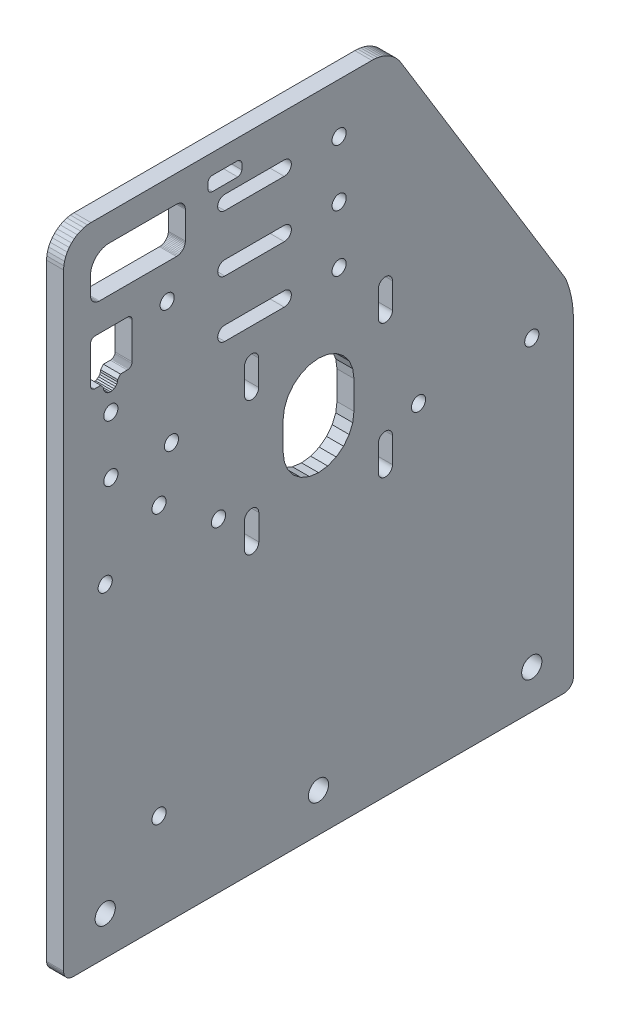
from build123d import *

# Parameters (mm, degrees)
SKETCH1_R           = 3.5685
SKETCH1_R_2         = 2.500000001
SKETCH1_R_3         = 2.5
BOSS_EXTRUDE1_DEPTH = 6


with BuildPart() as part:
    # Sketch1 → Boss-Extrude1 (new body)
    with BuildSketch(Plane(origin=(0, 0, 0), x_dir=(0, -1, 0), z_dir=(-1, 0, 0))):
        Polygon((-590.212112636, -1614.243728334), (-495.230350852, -1672.335619946), (-492.985489602, -1673.198794727), (-490.688058814, -1673.910331453), (-488.34828871, -1674.467061724), (-485.976598042, -1674.866506478), (-483.583547703, -1675.10688703), (-481.179793697, -1675.18713299), (-371.826596113, -1675.18713299), (-371.387664827, -1675.158363913), (-370.956243777, -1675.072548931), (-370.539714696, -1674.931156361), (-370.145204514, -1674.736605469), (-369.779463407, -1674.492225074), (-369.448749309, -1674.202196594), (-369.158720829, -1673.871482496), (-368.914340435, -1673.50574139), (-368.719789543, -1673.111231207), (-368.578396973, -1672.694702127), (-368.49258199, -1672.263281077), (-368.463812914, -1671.82434979), (-368.463812914, -1498.50991619), (-368.49258199, -1498.070984903), (-368.578396973, -1497.639563853), (-368.719789543, -1497.223034773), (-368.914340435, -1496.82852459), (-369.158720829, -1496.462783484), (-369.448749309, -1496.132069386), (-369.779463407, -1495.842040906), (-370.145204514, -1495.597660511), (-370.539714696, -1495.403109619), (-370.956243777, -1495.261717049), (-371.387664827, -1495.175902067), (-371.826596113, -1495.14713299), (-586.288106544, -1495.145619765), (-587.549717355, -1495.228301598), (-588.789742622, -1495.474950056), (-589.98696498, -1495.881344878), (-591.12089944, -1496.440532473), (-592.172143895, -1497.142944902), (-593.122711102, -1497.976563587), (-593.956336446, -1498.927124952), (-594.658756242, -1499.978364486), (-595.217951782, -1501.112295027), (-595.624354993, -1502.309514537), (-595.87101214, -1503.549538076), (-595.953702813, -1504.811148308), (-595.953702813, -1603.994310614), (-595.910202971, -1605.015955139), (-595.780018321, -1606.030204482), (-595.564091204, -1607.029716989), (-595.263984611, -1608.007257681), (-594.881870865, -1608.955750621), (-594.420515902, -1609.868330136), (-593.883259242, -1610.738390509), (-593.273989822, -1611.559633802), (-592.597117845, -1612.326115438), (-591.857542854, -1613.032287234), (-591.060618269, -1613.673037558), align=None)
        with Locations(Location((-382.159118976, -1509.84713299, 0), (0, 0, 90))):
            Circle(SKETCH1_R, mode=Mode.SUBTRACT)
        with Locations(Location((-382.159118976, -1585.16713299, 0), (0, 0, 90))):
            Circle(SKETCH1_R, mode=Mode.SUBTRACT)
        with Locations(Location((-382.159118976, -1660.48713299, 0), (0, 0, 90))):
            Circle(SKETCH1_R, mode=Mode.SUBTRACT)
        with Locations(Location((-538.399280751, -1592.457817223, 0), (0, 0, 90))):
            Circle(SKETCH1_R_2, mode=Mode.SUBTRACT)
        with Locations(Location((-558.44846865, -1592.457817223, 0), (0, 0, 90))):
            Circle(SKETCH1_R_2, mode=Mode.SUBTRACT)
        with Locations(Location((-578.44846865, -1592.457817223, 0), (0, 0, 90))):
            Circle(SKETCH1_R_2, mode=Mode.SUBTRACT)
        with Locations(Location((-534.443559506, -1511.847133017, 0), (0, 0, 90))):
            Circle(SKETCH1_R_2, mode=Mode.SUBTRACT)
        with Locations(Location((-558.402442437, -1531.722977175, 0), (0, 0, 90))):
            Circle(SKETCH1_R_2, mode=Mode.SUBTRACT)
        with Locations(Location((-514.443559639, -1511.847132679, 0), (0, 0, 90))):
            Circle(SKETCH1_R_2, mode=Mode.SUBTRACT)
        with Locations(Location((-514.443559639, -1533.238984755, 0), (0, 0, 90))):
            Circle(SKETCH1_R_2, mode=Mode.SUBTRACT)
        with Locations(Location((-497.496167838, -1528.847132988, 0), (0, 0, 90))):
            Circle(SKETCH1_R_3, mode=Mode.SUBTRACT)
        with Locations(Location((-482.799118976, -1549.84713299, 0), (0, 0, 90))):
            Circle(SKETCH1_R_2, mode=Mode.SUBTRACT)
        with Locations(Location((-482.799118976, -1509.84713299, 0), (0, 0, 90))):
            Circle(SKETCH1_R_2, mode=Mode.SUBTRACT)
        with Locations(Location((-482.799118976, -1620.48713299, 0), (0, 0, 90))):
            Circle(SKETCH1_R_2, mode=Mode.SUBTRACT)
        with Locations(Location((-482.799118977, -1660.487132991, 0), (0, 0, 90))):
            Circle(SKETCH1_R_2, mode=Mode.SUBTRACT)
        with Locations(Location((-402.49616799, -1528.847132989, 0), (0, 0, 90))):
            Circle(SKETCH1_R_2, mode=Mode.SUBTRACT)
        with BuildLine():
            Line((-575.977758464, -1552.084054241), (-575.977758464, -1573.056806032))
            ThreePointArc((-575.977758464, -1573.056806032), (-578.457148005, -1575.577342323), (-580.977684295, -1573.097952782))
            Line((-580.977684295, -1573.097952782), (-580.977684295, -1552.084054231))
            ThreePointArc((-580.977684295, -1552.084054231), (-578.477721375, -1549.570437307), (-575.977758464, -1552.084054241))
        make_face(mode=Mode.SUBTRACT)
        with BuildLine():
            Line((-535.977790671, -1552.085412401), (-535.977790671, -1573.058164192))
            ThreePointArc((-535.977790671, -1573.058164192), (-538.457180211, -1575.578700483), (-540.977716502, -1573.099310942))
            Line((-540.977716502, -1573.099310942), (-540.977716502, -1552.085412391))
            ThreePointArc((-540.977716502, -1552.085412391), (-538.477753581, -1549.571795467), (-535.977790671, -1552.085412401))
        make_face(mode=Mode.SUBTRACT)
        with BuildLine():
            Line((-555.97770846, -1552.099177314), (-555.97770846, -1573.085546029))
            ThreePointArc((-555.97770846, -1573.085546029), (-558.463906443, -1575.599273877), (-560.977634291, -1573.113075895))
            Line((-560.977634291, -1573.113075895), (-560.977634291, -1552.099177304))
            ThreePointArc((-560.977634291, -1552.099177304), (-558.47767137, -1549.58556036), (-555.97770846, -1552.099177314))
        make_face(mode=Mode.SUBTRACT)
        with BuildLine():
            Line((-524.913709892, -1559.055192962), (-515.913733671, -1559.055192962))
            ThreePointArc((-515.913733671, -1559.055192962), (-513.413733671, -1561.555192962), (-515.913733671, -1564.055192962))
            Line((-515.913733671, -1564.055192962), (-524.913709892, -1564.055192962))
            ThreePointArc((-524.913709892, -1564.055192962), (-527.413709892, -1561.555192962), (-524.913709892, -1559.055192962))
        make_face(mode=Mode.SUBTRACT)
        with BuildLine():
            Line((-524.913709892, -1606.299062763), (-515.913733671, -1606.299062763))
            ThreePointArc((-515.913733671, -1606.299062763), (-513.413733671, -1608.799062763), (-515.913733671, -1611.299062763))
            Line((-515.913733671, -1611.299062763), (-524.913709892, -1611.299062763))
            ThreePointArc((-524.913709892, -1611.299062763), (-527.413709892, -1608.799062763), (-524.913709892, -1606.299062763))
        make_face(mode=Mode.SUBTRACT)
        with BuildLine():
            Line((-477.66984009, -1606.299062763), (-468.669863869, -1606.299062763))
            ThreePointArc((-468.669863869, -1606.299062763), (-466.169863869, -1608.799062763), (-468.669863869, -1611.299062763))
            Line((-468.669863869, -1611.299062763), (-477.66984009, -1611.299062763))
            ThreePointArc((-477.66984009, -1611.299062763), (-480.16984009, -1608.799062763), (-477.66984009, -1606.299062763))
        make_face(mode=Mode.SUBTRACT)
        with BuildLine():
            Line((-477.669839463, -1559.052819647), (-468.669863869, -1559.055192962))
            ThreePointArc((-468.669863869, -1559.055192962), (-466.159015015, -1561.567366398), (-468.671188452, -1564.078215252))
            Line((-468.671188452, -1564.078215252), (-477.669845536, -1564.075842286))
            ThreePointArc((-477.669845536, -1564.075842286), (-480.18069465, -1561.564327931), (-477.669839463, -1559.052819647))
        make_face(mode=Mode.SUBTRACT)
        Polygon((-586.033555203, -1536.579108211), (-586.214987166, -1536.211200586), (-586.346845371, -1535.822758839), (-586.426873689, -1535.420429315), (-586.453702813, -1535.011095984), (-586.453702813, -1511.296236305), (-586.396818705, -1510.428352529), (-586.227139684, -1509.575318486), (-585.947569005, -1508.751729823), (-585.5628902, -1507.971678372), (-585.079685229, -1507.248511028), (-584.506221865, -1506.594601387), (-583.852312223, -1506.021138022), (-583.12914488, -1505.537933052), (-582.349093428, -1505.153254247), (-581.525504766, -1504.873683568), (-580.672470722, -1504.704004546), (-579.804586946, -1504.647120438), (-573.616888973, -1504.647120438), (-573.207555642, -1504.673949562), (-572.805226118, -1504.75397788), (-572.416784371, -1504.885836086), (-572.048876746, -1505.067268048), (-571.707798245, -1505.295169417), (-571.399384815, -1505.565640735), (-571.128913497, -1505.874054164), (-570.901012129, -1506.215132665), (-570.719580166, -1506.58304029), (-570.587721961, -1506.971482038), (-570.507693643, -1507.373811562), (-570.480864519, -1507.783144892), (-570.480864519, -1535.011095984), (-570.507693643, -1535.420429315), (-570.587721961, -1535.822758839), (-570.719580166, -1536.211200586), (-570.901012129, -1536.579108211), (-571.128913497, -1536.920186712), (-571.399384815, -1537.228600142), (-571.707798245, -1537.49907146), (-572.048876746, -1537.726972829), (-572.416784371, -1537.908404791), (-572.805226118, -1538.040262996), (-573.207555642, -1538.120291315), (-573.616888973, -1538.147120438), (-583.317678359, -1538.147120438), (-583.72701169, -1538.120291315), (-584.129341214, -1538.040262996), (-584.517782961, -1537.908404791), (-584.885690586, -1537.726972828), (-585.226769087, -1537.49907146), (-585.535182516, -1537.228600142), (-585.805653835, -1536.920186712), align=None, mode=Mode.SUBTRACT)
        Polygon((-560.539732338, -1505.878268758), (-560.469558584, -1505.671543545), (-560.373002121, -1505.475746407), (-560.251715057, -1505.294227488), (-560.107772647, -1505.130092628), (-559.943637786, -1504.986150218), (-559.762118868, -1504.864863154), (-559.56632173, -1504.768306692), (-559.359596516, -1504.698132938), (-559.131202133, -1504.647120439), (-558.927636825, -1504.641264366), (-548.4808636, -1504.645157132), (-545.881846575, -1504.645157132), (-545.667730411, -1504.687747485), (-545.461005198, -1504.757921239), (-545.26520806, -1504.854477702), (-545.083689141, -1504.975764766), (-544.919554281, -1505.119707176), (-544.775611871, -1505.283842037), (-544.654324807, -1505.465360956), (-544.557768345, -1505.661158094), (-544.487594591, -1505.867883307), (-544.445004238, -1506.081999471), (-544.441434684, -1508.267709423), (-543.221041992, -1509.237688263), (-542.573960137, -1509.322613597), (-541.970907354, -1509.572122279), (-541.452980696, -1509.969210703), (-541.055476008, -1510.486817951), (-540.805482577, -1511.089669943), (-540.720037042, -1511.736683313), (-540.804962376, -1512.383765169), (-541.054471058, -1512.986817951), (-541.451559482, -1513.504744609), (-541.96916673, -1513.902249297), (-542.572018722, -1514.152242729), (-543.219032092, -1514.237688263), (-544.432285676, -1515.207667102), (-544.430726027, -1517.677645941), (-544.487594599, -1518.109605632), (-544.557768353, -1518.316330846), (-544.654324816, -1518.512127983), (-544.77561188, -1518.693646902), (-544.91955429, -1518.857781763), (-545.083689151, -1519.001724172), (-545.26520807, -1519.123011236), (-545.461005208, -1519.219567699), (-545.667730421, -1519.289741453), (-546.099691027, -1519.348570172), (-558.957839921, -1519.342717258), (-559.145480362, -1519.342717258), (-559.359596526, -1519.300126905), (-559.566321739, -1519.229953151), (-559.762118877, -1519.133396688), (-559.943637796, -1519.012109624), (-560.107772656, -1518.868167214), (-560.251715066, -1518.704032353), (-560.37300213, -1518.522513435), (-560.469558592, -1518.326716297), (-560.539732347, -1518.119991083), (-560.582322699, -1517.905874919), (-560.582322699, -1517.679609247), (-560.568044472, -1506.083962777), align=None, mode=Mode.SUBTRACT)
        Polygon((-512.609294248, -1578.937135138), (-510.622811466, -1576.348300373), (-508.033976701, -1574.36181759), (-505.019214764, -1573.113062308), (-501.7839767, -1572.687135137), (-491.783976402, -1572.687135137), (-488.548738338, -1573.113062308), (-485.533976401, -1574.36181759), (-482.945141636, -1576.348300373), (-480.958658854, -1578.937135138), (-479.709903572, -1581.951897074), (-479.283976401, -1585.187135138), (-479.709903572, -1588.422373202), (-480.958658854, -1591.437135139), (-482.945141636, -1594.025969904), (-485.533976401, -1596.012452687), (-488.548738338, -1597.261207968), (-491.783976402, -1597.68713514), (-501.7839767, -1597.68713514), (-505.019214764, -1597.261207968), (-508.033976701, -1596.012452687), (-510.622811466, -1594.025969904), (-512.609294248, -1591.437135139), (-513.85804953, -1588.422373202), (-514.283976701, -1585.187135138), (-513.85804953, -1581.951897074), align=None, mode=Mode.SUBTRACT)
        with BuildLine():
            Line((-588.98086362, -1556.648178727), (-588.98086362, -1547.550419842))
            ThreePointArc((-588.98086362, -1547.550419842), (-588.50376059, -1546.590680791), (-587.544021697, -1546.113577446))
            Line((-587.544021697, -1546.113577446), (-585.643575513, -1546.099299227))
            ThreePointArc((-585.643575513, -1546.099299227), (-584.463439705, -1546.588127429), (-583.974611428, -1547.768263206))
            Line((-583.974611428, -1547.768263206), (-583.988889647, -1556.648178564))
            ThreePointArc((-583.988889647, -1556.648178564), (-584.465992569, -1557.607917612), (-585.425731394, -1558.085020984))
            Line((-585.425731394, -1558.085020984), (-587.544021696, -1558.085020984))
            ThreePointArc((-587.544021696, -1558.085020984), (-588.506313615, -1557.610470755), (-588.98086362, -1556.648178727))
        make_face(mode=Mode.SUBTRACT)
    extrude(amount=-BOSS_EXTRUDE1_DEPTH)


solid = part.part
